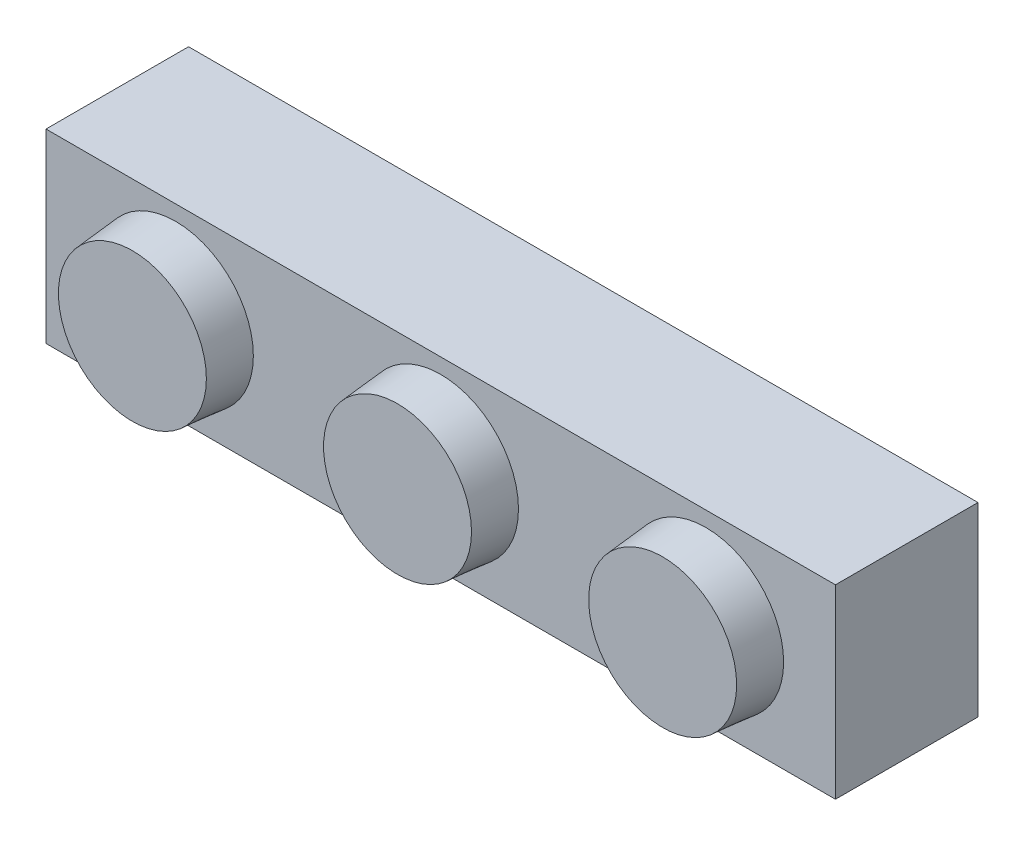
from build123d import *

# Parameters (mm, degrees)
SKETCH1_W                     = 2320.925
SKETCH1_H                     = 419.1
BOSS_EXTRUDE1_DEPTH           = 546.1
SKETCH2_R                     = 228.6
BOSS_EXTRUDE2_DEPTH           = 127
BOSS_EXTRUDE2_DRAFT           = 5
BOSS_EXTRUDE2_PROFILE_2_DEPTH = 127
BOSS_EXTRUDE2_PROFILE_2_DRAFT = 5
BOSS_EXTRUDE2_PROFILE_3_DEPTH = 127
BOSS_EXTRUDE2_PROFILE_3_DRAFT = 5


with BuildPart() as part:
    # Sketch1 → Boss-Extrude1 (new body)
    with BuildSketch(Plane(origin=(0, 0, 0), x_dir=(1, 0, 0), z_dir=(0, 1, 0))):
        Rectangle(SKETCH1_W, SKETCH1_H)
    extrude(amount=BOSS_EXTRUDE1_DEPTH)


with BuildPart() as boss_extrude2_tool:
    # Sketch2 → Boss-Extrude2 (with draft: the straight prism first)
    with BuildSketch(Plane.XY.offset(209.55)):
        with Locations((0, 273.05)):
            Circle(SKETCH2_R)
    extrude(amount=BOSS_EXTRUDE2_DEPTH)
    # Boss-Extrude2: the draft: its side faces are tilted about the plane it starts from
    boss_extrude2_sides = [boss_extrude2_tool.faces().sort_by_distance(p)[0] for p in [
        (-228.6, 273.05, 273.05),
    ]]
    draft(boss_extrude2_sides, Plane.XY.offset(209.55), BOSS_EXTRUDE2_DRAFT)


with BuildPart() as part_1:
    add(part.part)

    # Boss-Extrude2: add boss_extrude2_tool
    add(boss_extrude2_tool.part)


with BuildPart() as boss_extrude2_profile_2_tool:
    # Sketch2 → Boss-Extrude2 profile 2 (with draft: the straight prism first)
    with BuildSketch(Plane.XY.offset(209.55)):
        with Locations((779.4625, 273.05)):
            Circle(SKETCH2_R)
    extrude(amount=BOSS_EXTRUDE2_PROFILE_2_DEPTH)
    # Boss-Extrude2 profile 2: the draft: its side faces are tilted about the plane it starts from
    boss_extrude2_profile_2_sides = [boss_extrude2_profile_2_tool.faces().sort_by_distance(p)[0] for p in [
        (550.8625, 273.05, 273.05),
    ]]
    draft(boss_extrude2_profile_2_sides, Plane.XY.offset(209.55), BOSS_EXTRUDE2_PROFILE_2_DRAFT)


with BuildPart() as part_2:
    add(part_1.part)

    # Boss-Extrude2 profile 2: add boss_extrude2_profile_2_tool
    add(boss_extrude2_profile_2_tool.part)


with BuildPart() as boss_extrude2_profile_3_tool:
    # Sketch2 → Boss-Extrude2 profile 3 (with draft: the straight prism first)
    with BuildSketch(Plane.XY.offset(209.55)):
        with Locations((-779.4625, 273.05)):
            Circle(SKETCH2_R)
    extrude(amount=BOSS_EXTRUDE2_PROFILE_3_DEPTH)
    # Boss-Extrude2 profile 3: the draft: its side faces are tilted about the plane it starts from
    boss_extrude2_profile_3_sides = [boss_extrude2_profile_3_tool.faces().sort_by_distance(p)[0] for p in [
        (-1008.0625, 273.05, 273.05),
    ]]
    draft(boss_extrude2_profile_3_sides, Plane.XY.offset(209.55), BOSS_EXTRUDE2_PROFILE_3_DRAFT)


with BuildPart() as part_3:
    add(part_2.part)

    # Boss-Extrude2 profile 3: add boss_extrude2_profile_3_tool
    add(boss_extrude2_profile_3_tool.part)


solid = part_3.part
